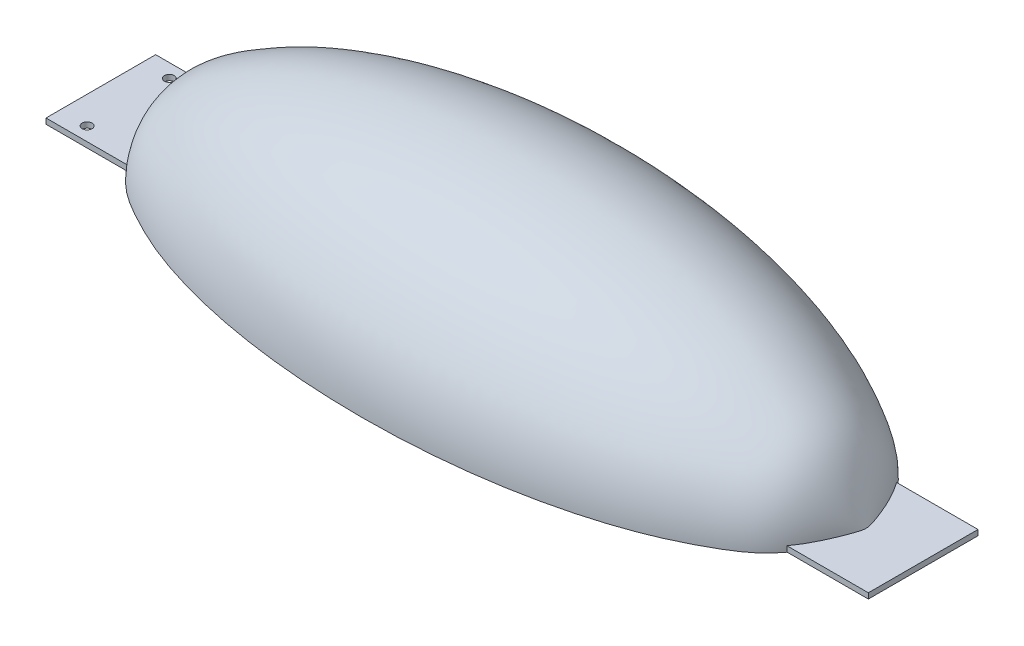
from build123d import *

# Parameters (mm, degrees)
SKETCH2_W           = 360
SKETCH2_H           = 160
CUT_EXTRUDE1_DEPTH  = 80
SKETCH3_W           = 30
SKETCH3_H           = 40
BOSS_EXTRUDE1_DEPTH = 2
SKETCH4_R           = 1.8
CUT_EXTRUDE2_DEPTH  = 3


with BuildPart() as part:
    # Sketch1 → Revolve1 (revolve)
    with BuildSketch(Plane.XY):
        with BuildLine():
            Line((-260, 0), (0, 0))
            add(Edge.make_bspline(
                [(0, 0), (-3.347287608, 8.830491747), (-8.637057756, 22.785453825), (-25.560999876, 33.02157361), (-38.692183286, 39.434199177), (-51.852349815, 44.123794884), (-64.89948422, 47.74936681), (-77.936573384, 50.514956153), (-90.95830586, 52.566616186), (-103.974926365, 53.983885889), (-116.988117972, 54.816743473), (-130, 55.091544132), (-143.011882028, 54.816743473), (-156.025073635, 53.983885889), (-169.04169414, 52.566616186), (-182.063426616, 50.514956153), (-195.10051578, 47.74936681), (-208.147650185, 44.123794884), (-221.307816714, 39.434199177), (-234.439000124, 33.02157361), (-251.362942244, 22.785453825), (-256.652712392, 8.830491747), (-260, 0)],
                knots=[0, 0, 0, 0, 0.090648646, 0.143253451, 0.191238799, 0.237211898, 0.282076785, 0.326262316, 0.37001128, 0.413479751, 0.456779596, 0.5, 0.543220404, 0.586520249, 0.62998872, 0.673737684, 0.717923215, 0.762788102, 0.808761201, 0.856746549, 0.909351354, 1, 1, 1, 1], degree=3))
        make_face()
    revolve(axis=Axis((10, 0, 0), (-1, 0, 0)))

    # Sketch2 → Cut-Extrude1 (cut)
    with BuildSketch(Plane(origin=(0, 0, 0), x_dir=(1, 0, 0), z_dir=(0, 1, 0))):
        with Locations((-130, 0)):
            Rectangle(SKETCH2_W, SKETCH2_H)
    extrude(amount=-CUT_EXTRUDE1_DEPTH, mode=Mode.SUBTRACT)

    # Sketch3 → Boss-Extrude1 (add)
    with BuildSketch(Plane(origin=(0, 0, 0), x_dir=(1, 0, 0), z_dir=(0, 1, 0))):
        with Locations((-265, 0)):
            Rectangle(SKETCH3_W, SKETCH3_H)
        with Locations((5, 0)):
            Rectangle(SKETCH3_W, SKETCH3_H)
    extrude(amount=BOSS_EXTRUDE1_DEPTH)

    # Sketch4 → Cut-Extrude2 (cut)
    with BuildSketch(Plane(origin=(0, 0, 0), x_dir=(1, 0, 0), z_dir=(0, 1, 0))):
        with Locations(Location((-270, -15, 0), (0, 0, 90))):
            Circle(SKETCH4_R)
        with Locations(Location((-270, 15, 0), (0, 0, 90))):
            Circle(SKETCH4_R)
    extrude(amount=CUT_EXTRUDE2_DEPTH, mode=Mode.SUBTRACT)


solid = part.part
